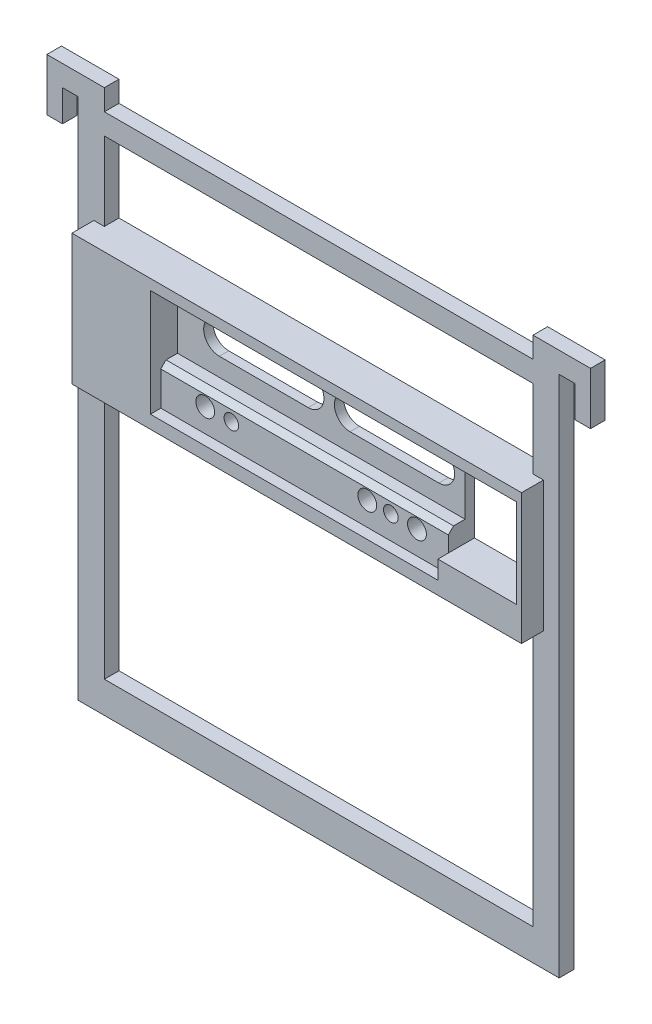
from build123d import *

# Parameters (mm, degrees)
SKETCH_1_W          = 86
SKETCH_1_H          = 25
EXTRUDE_1_DEPTH     = 7
SKETCH_2_W          = 15
SKETCH_2_H          = 17
CUT_EXTRUDE_1_DEPTH = 90.833178726
SKETCH_3_W          = 55
SKETCH_3_H          = 13
CUT_EXTRUDE_2_DEPTH = 5.2
SKETCH_4_W          = 55
SKETCH_4_H          = 7.5
CUT_EXTRUDE_3_DEPTH = 2
SKETCH_5_R          = 1.8
CUT_EXTRUDE_4_DEPTH = 90.699498326
SKETCH_6_R          = 1.4
CUT_EXTRUDE_5_DEPTH = 90.699498326
CUT_EXTRUDE_6_DEPTH = 90.710868907
CHAMFER_1_SIZE      = 1
SKETCH_8_W          = 82
SKETCH_8_H          = 48
EXTRUDE_2_DEPTH     = 2.8


with BuildPart() as part:
    # 草图1 → 凸台-拉伸1 (new body)
    with BuildSketch(Plane.XY):
        with Locations((43, 12.5)):
            Rectangle(SKETCH_1_W, SKETCH_1_H)
    extrude(amount=EXTRUDE_1_DEPTH)

    # 草图2 → 切除-拉伸1 (cut, through all)
    with BuildSketch(Plane.XY.offset(7)):
        with Locations((77.5, 14.5)):
            Rectangle(SKETCH_2_W, SKETCH_2_H)
    extrude(amount=-CUT_EXTRUDE_1_DEPTH, mode=Mode.SUBTRACT)

    # 草图3 → 切除-拉伸2 (cut)
    with BuildSketch(Plane.XY.offset(7)):
        with Locations((42.5, 16.5)):
            Rectangle(SKETCH_3_W, SKETCH_3_H)
    extrude(amount=-CUT_EXTRUDE_2_DEPTH, mode=Mode.SUBTRACT)

    # 草图4 → 切除-拉伸3 (cut)
    with BuildSketch(Plane.XY.offset(7)):
        with Locations((42.5, 6.25)):
            Rectangle(SKETCH_4_W, SKETCH_4_H)
    extrude(amount=-CUT_EXTRUDE_3_DEPTH, mode=Mode.SUBTRACT)

    # 草图5 → 切除-拉伸4 (cut, through all)
    with BuildSketch(Plane.XY.offset(5)):
        with Locations((64, 7)):
            Circle(SKETCH_5_R)
        with Locations((54.5, 7)):
            Circle(SKETCH_5_R)
        with Locations((23.5, 7)):
            Circle(SKETCH_5_R)
    extrude(amount=-CUT_EXTRUDE_4_DEPTH, mode=Mode.SUBTRACT)

    # 草图6 → 切除-拉伸5 (cut, through all)
    with BuildSketch(Plane.XY.offset(5)):
        with Locations((59, 7)):
            Circle(SKETCH_6_R)
        with Locations((28.5, 7)):
            Circle(SKETCH_6_R)
    extrude(amount=-CUT_EXTRUDE_5_DEPTH, mode=Mode.SUBTRACT)

    # 草图7 → 切除-拉伸6 (cut, through all)
    with BuildSketch(Plane.XY.offset(1.8)):
        with BuildLine():
            Line((23, 19.5), (40, 19.5))
            ThreePointArc((40, 19.5), (43, 16.5), (40, 13.5))
            Line((40, 13.5), (23, 13.5))
            ThreePointArc((23, 13.5), (20, 16.5), (23, 19.5))
        make_face()
        with BuildLine():
            Line((48, 19.5), (65, 19.5))
            ThreePointArc((65, 19.5), (68, 16.5), (65, 13.5))
            Line((65, 13.5), (48, 13.5))
            ThreePointArc((48, 13.5), (45, 16.5), (48, 19.5))
        make_face()
    extrude(amount=-CUT_EXTRUDE_6_DEPTH, mode=Mode.SUBTRACT)

    # 倒角1
    chamfer_1_edges = [part.edges().sort_by_distance(p)[0] for p in [
        (42.5, 10, 5),
    ]]
    chamfer(chamfer_1_edges, length=CHAMFER_1_SIZE)

    # 草图8 → 凸台-拉伸2 (add)
    with BuildSketch(Plane(origin=(0, 0, 0), x_dir=(-1, 0, 0), z_dir=(0, 0, -1))):
        Polygon((-95, 38), (-92, 38), (-92, 44), (-89, 44), (-89, -56), (3, -56), (3, 44), (6, 44), (6, 38), (9, 38), (9, 48), (-2, 48), (-2, 44), (-84, 44), (-84, 48), (-95, 48), align=None)
        Polygon((-86, 0), (0, 0), (0, 25), (-2, 25), (-2, 40), (-84, 40), (-84, 25), (-86, 25), align=None, mode=Mode.SUBTRACT)
        with Locations((-43, -26)):
            Rectangle(SKETCH_8_W, SKETCH_8_H, mode=Mode.SUBTRACT)
    extrude(amount=-EXTRUDE_2_DEPTH)


solid = part.part
